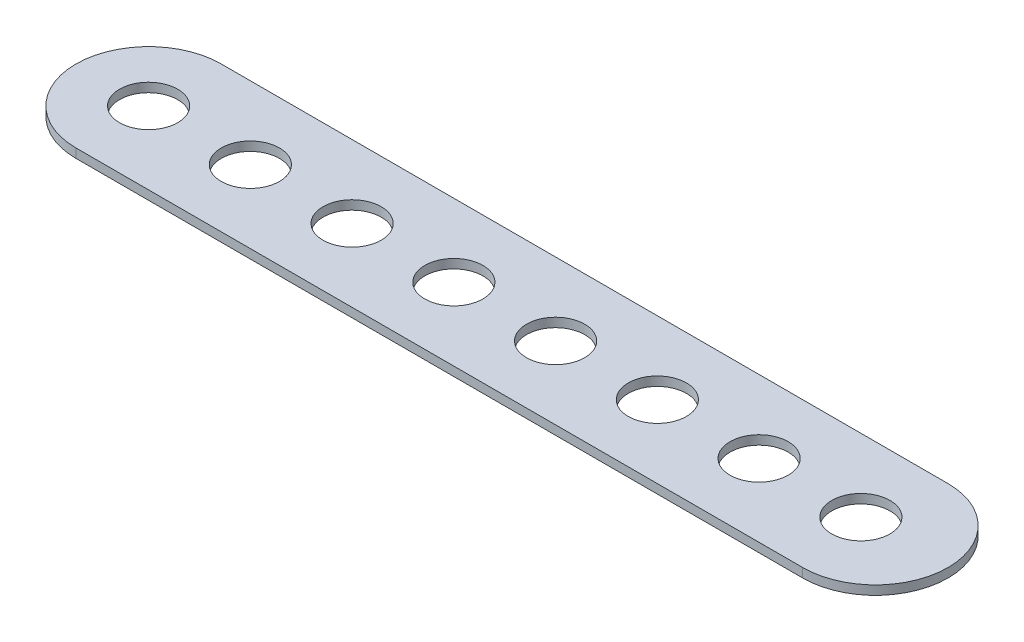
from build123d import *

# Parameters (mm, degrees)
BOSS_EXTRUDE1_DEPTH = 3.175
SKETCH3_R           = 10.16
CUT_EXTRUDE1_DEPTH  = 281.570134948
LPATTERN1_COUNT     = 8
LPATTERN1_PITCH     = 35.56


with BuildPart() as part:
    # Sketch1 → Boss-Extrude1 (new body)
    with BuildSketch(Plane(origin=(0, 0, 0), x_dir=(1, 0, 0), z_dir=(0, 1, 0))):
        with BuildLine():
            Line((0, 25.4), (-254, 25.4))
            ThreePointArc((-254, 25.4), (-279.4, 0), (-254, -25.4))
            Line((-254, -25.4), (0, -25.4))
            ThreePointArc((0, -25.4), (25.4, 0), (0, 25.4))
        make_face()
    extrude(amount=BOSS_EXTRUDE1_DEPTH)

    # Sketch3 → Cut-Extrude1 (cut, through all)
    with BuildSketch(Plane(origin=(0, 3.175, 0), x_dir=(1, 0, 0), z_dir=(0, 1, 0))):
        with Locations(Location((-254, 0, 0), (0, 0, 270))):
            Circle(SKETCH3_R)
    cut_extrude1 = extrude(amount=-CUT_EXTRUDE1_DEPTH, mode=Mode.SUBTRACT)

    # LPattern1: Cut-Extrude1 ×8
    with Locations(*[(i * LPATTERN1_PITCH, 0, 0) for i in range(1, LPATTERN1_COUNT)]):
        add(cut_extrude1, mode=Mode.SUBTRACT)


solid = part.part
